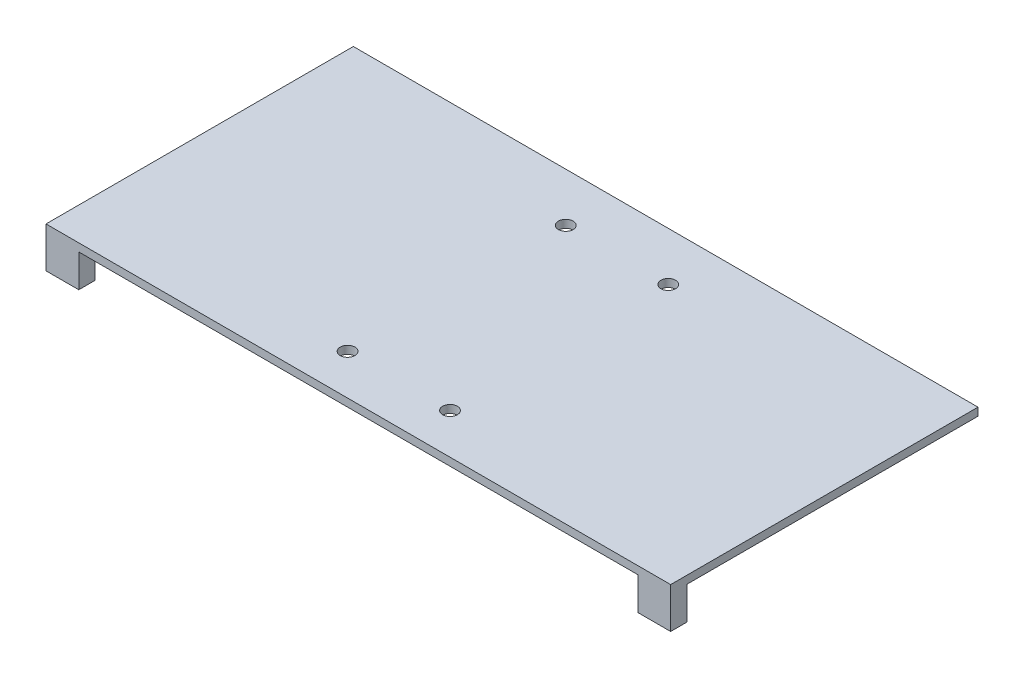
from build123d import *

# Parameters (mm, degrees)
SKETCH1_W           = 96.799999948
SKETCH1_H           = 47.62500254
BOSS_EXTRUDE1_DEPTH = 1.2192
CUT_EXTRUDE1_REACH  = 109.888
SKETCH5_R           = 1.143
CUT_EXTRUDE2_REACH  = 109.888
SKETCH6_R           = 1.143
SKETCH7_W           = 5.08
SKETCH7_H           = 2.54
BOSS_EXTRUDE2_DEPTH = 5.08


with BuildPart() as part:
    # Sketch1 → Boss-Extrude1 (new body)
    with BuildSketch(Plane(origin=(0, 0, 0), x_dir=(1, 0, 0), z_dir=(0, 1, 0))):
        with Locations((48.399999974, -23.81250127)):
            Rectangle(SKETCH1_W, SKETCH1_H)
    extrude(amount=BOSS_EXTRUDE1_DEPTH)

    # Sketch5 → Cut-Extrude1 (cut, up to next)
    with BuildSketch(Plane(origin=(0, 1.2192, 0), x_dir=(1, 0, 0), z_dir=(0, 1, 0)), mode=Mode.PRIVATE) as cut_extrude1_sk1:
        with Locations(Location((56.3375, -7.540625, 0), (0, 0, 270))):
            Circle(SKETCH5_R)
    cut_extrude1_tool1 = extrude(cut_extrude1_sk1.sketch, amount=-CUT_EXTRUDE1_REACH, mode=Mode.PRIVATE) & part.part
    # Sketch5 → Cut-Extrude1 (cut, up to next)
    with BuildSketch(Plane(origin=(0, 1.2192, 0), x_dir=(1, 0, 0), z_dir=(0, 1, 0)), mode=Mode.PRIVATE) as cut_extrude1_sk2:
        with Locations(Location((40.4625, -7.540625, 0), (0, 0, 270))):
            Circle(SKETCH5_R)
    cut_extrude1_tool2 = extrude(cut_extrude1_sk2.sketch, amount=-CUT_EXTRUDE1_REACH, mode=Mode.PRIVATE) & part.part
    add(cut_extrude1_tool1.solids().sort_by_distance((56.3375, 1.2192, 7.540625))[0], mode=Mode.SUBTRACT)
    add(cut_extrude1_tool2.solids().sort_by_distance((40.4625, 1.2192, 7.540625))[0], mode=Mode.SUBTRACT)

    # Sketch6 → Cut-Extrude2 (cut, up to next)
    with BuildSketch(Plane(origin=(0, 1.2192, 0), x_dir=(1, 0, 0), z_dir=(0, 1, 0)), mode=Mode.PRIVATE) as cut_extrude2_sk1:
        with Locations(Location((56.3375, -41.35437754, 0), (0, 0, 270))):
            Circle(SKETCH6_R)
    cut_extrude2_tool1 = extrude(cut_extrude2_sk1.sketch, amount=-CUT_EXTRUDE2_REACH, mode=Mode.PRIVATE) & part.part
    # Sketch6 → Cut-Extrude2 (cut, up to next)
    with BuildSketch(Plane(origin=(0, 1.2192, 0), x_dir=(1, 0, 0), z_dir=(0, 1, 0)), mode=Mode.PRIVATE) as cut_extrude2_sk2:
        with Locations(Location((40.4625, -41.35437754, 0), (0, 0, 270))):
            Circle(SKETCH6_R)
    cut_extrude2_tool2 = extrude(cut_extrude2_sk2.sketch, amount=-CUT_EXTRUDE2_REACH, mode=Mode.PRIVATE) & part.part
    add(cut_extrude2_tool1.solids().sort_by_distance((56.3375, 1.2192, 41.354378))[0], mode=Mode.SUBTRACT)
    add(cut_extrude2_tool2.solids().sort_by_distance((40.4625, 1.2192, 41.354378))[0], mode=Mode.SUBTRACT)

    # Sketch7 → Boss-Extrude2 (add)
    with BuildSketch(Plane(origin=(0, 0, 0), x_dir=(-1, 0, 0), z_dir=(0, -1, 0))):
        with Locations((-94.259999948, -46.35500254)):
            Rectangle(SKETCH7_W, SKETCH7_H)
        with Locations((-2.54, -46.35500254)):
            Rectangle(SKETCH7_W, SKETCH7_H)
    extrude(amount=BOSS_EXTRUDE2_DEPTH)


solid = part.part
